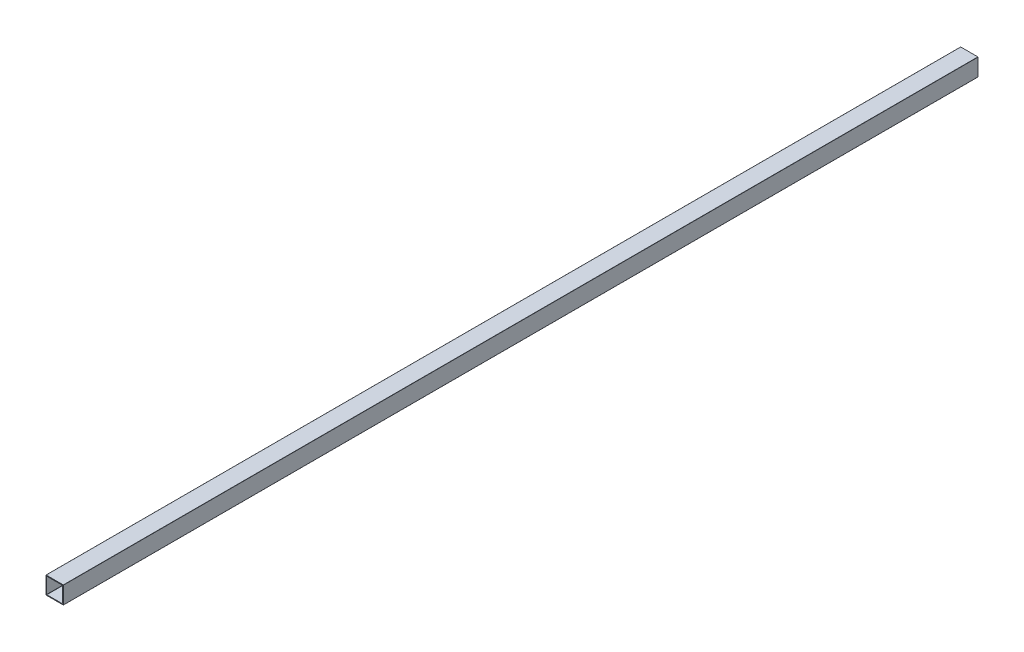
from build123d import *

# Parameters (mm, degrees)
CROQUIS1_W              = 114.3
CROQUIS1_H              = 114.3
CROQUIS1_W_2            = 105.2
CROQUIS1_H_2            = 105.2
SALIENTE_EXTRUIR1_DEPTH = 6000
REDONDEO1_R             = 1


with BuildPart() as part:
    # Croquis1 → Saliente-Extruir1 (new body)
    with BuildSketch(Plane.XY):
        Rectangle(CROQUIS1_W, CROQUIS1_H)
        Rectangle(CROQUIS1_W_2, CROQUIS1_H_2, mode=Mode.SUBTRACT)
    extrude(amount=-SALIENTE_EXTRUIR1_DEPTH)

    # Redondeo1
    redondeo1_edges = [part.edges().sort_by_distance(p)[0] for p in [
        (52.6, -52.6, -3000),
        (-52.6, -52.6, -3000),
        (-52.6, 52.6, -3000),
        (52.6, 52.6, -3000),
        (57.15, -57.15, -3000),
        (-57.15, -57.15, -3000),
        (-57.15, 57.15, -3000),
        (57.15, 57.15, -3000),
    ]]
    fillet(redondeo1_edges, radius=REDONDEO1_R)


solid = part.part
